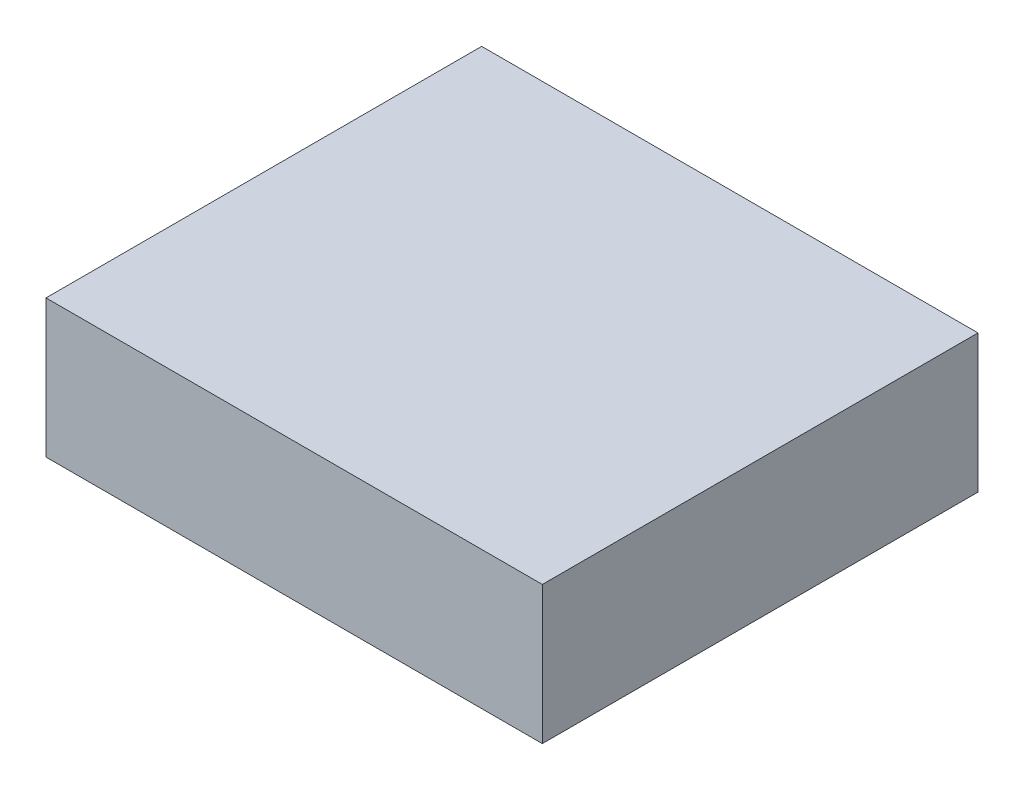
from build123d import *

# Parameters (mm, degrees)
SKETCH1_W           = 90
SKETCH1_H           = 79
BOSS_EXTRUDE1_DEPTH = 25
SKETCH2_W           = 15.220630369
SKETCH2_H           = 11.500031834
BOSS_EXTRUDE2_DEPTH = 4.5


with BuildPart() as part:
    # Sketch1 → Boss-Extrude1 (new body)
    with BuildSketch(Plane(origin=(0, 0, 0), x_dir=(1, 0, 0), z_dir=(0, 1, 0))):
        Rectangle(SKETCH1_W, SKETCH1_H)
    extrude(amount=BOSS_EXTRUDE1_DEPTH)

    # Sketch2 → Boss-Extrude2 (add)
    with BuildSketch(Plane.ZY.offset(45)):
        with Locations((-23.718815658, 13.387870105)):
            Rectangle(SKETCH2_W, SKETCH2_H)
    extrude(amount=BOSS_EXTRUDE2_DEPTH)


solid = part.part
